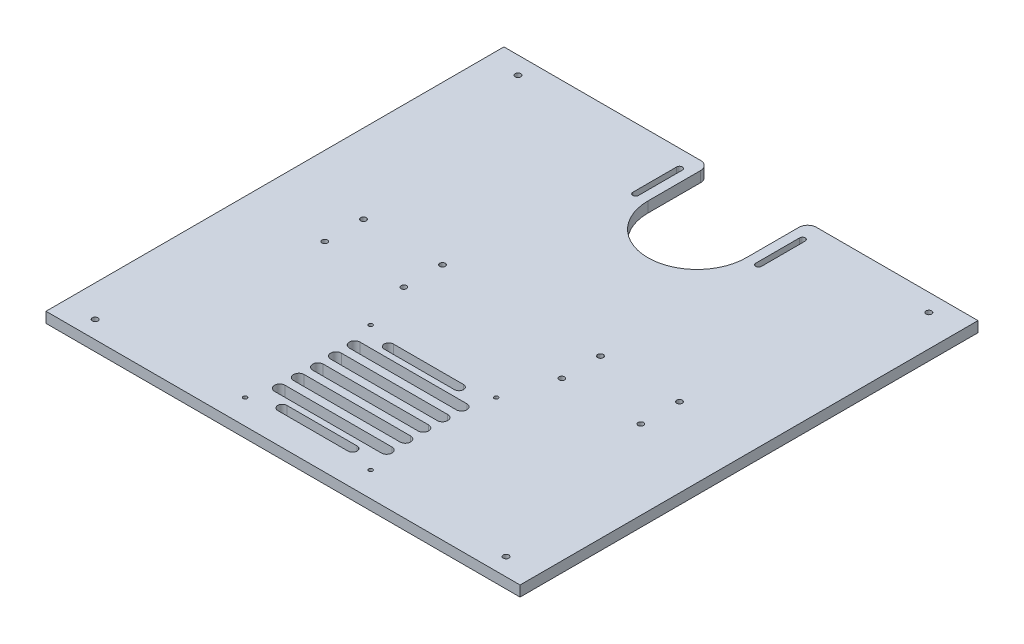
from build123d import *

# Parameters (mm, degrees)
SKETCH1_R               = 1.6
BOSS_EXTRUDE1_DEPTH     = 6
CUT_EXTRUDE1_DEPTH      = 203.20197823
CUT_EXTRUDE1_DEPTH_BACK = 203.20197823
SKETCH4_R               = 1.6
CUT_EXTRUDE2_DEPTH      = 10
CUT_EXTRUDE3_DEPTH      = 10
FILLET1_R               = 5
SKETCH6_R               = 1.125
CUT_EXTRUDE4_DEPTH      = 10
SKETCH7_R               = 1.55
CUT_EXTRUDE5_DEPTH      = 10


with BuildPart() as part:
    # Sketch1 → Boss-Extrude1 (new body)
    with BuildSketch(Plane(origin=(0, 0, 0), x_dir=(1, 0, 0), z_dir=(0, 1, 0))):
        Polygon((-145, 120), (125, 120), (125, -100.8), (125, -140.8), (-145, -140.8), (-145, -100.8), align=None)
        with Locations(Location((-100, -5, 0), (0, 0, 270))):
            Circle(SKETCH1_R, mode=Mode.SUBTRACT)
        with Locations(Location((80, -5, 0), (0, 0, 270))):
            Circle(SKETCH1_R, mode=Mode.SUBTRACT)
        with Locations(Location((-55, -5, 0), (0, 0, 270))):
            Circle(SKETCH1_R, mode=Mode.SUBTRACT)
        with Locations(Location((35, -5, 0), (0, 0, 270))):
            Circle(SKETCH1_R, mode=Mode.SUBTRACT)
    extrude(amount=BOSS_EXTRUDE1_DEPTH)

    # Sketch3 → Cut-Extrude1 (cut, two sides: drawn at the far end of the back side and taken through both)
    with BuildSketch(Plane(origin=(0, 6, 0), x_dir=(1, 0, 0), z_dir=(0, 1, 0)).offset(-CUT_EXTRUDE1_DEPTH_BACK)):
        with BuildLine():
            Line((-28, 85), (-28, 120))
            Line((-28, 120), (28, 120))
            Line((28, 120), (28, 85))
            ThreePointArc((28, 85), (0, 57), (-28, 85))
        make_face()
    extrude(amount=CUT_EXTRUDE1_DEPTH + CUT_EXTRUDE1_DEPTH_BACK, mode=Mode.SUBTRACT)

    # Sketch4 → Cut-Extrude2 (cut)
    with BuildSketch(Plane.XZ):
        with Locations(Location((107, -110, 0), (0, 0, 270))):
            Circle(SKETCH4_R)
        with Locations(Location((-127, -110, 0), (0, 0, 270))):
            Circle(SKETCH4_R)
        with Locations(Location((107, 130.8, 0), (0, 0, 270))):
            Circle(SKETCH4_R)
        with Locations(Location((-127, 130.8, 0), (0, 0, 270))):
            Circle(SKETCH4_R)
    extrude(amount=-CUT_EXTRUDE2_DEPTH, mode=Mode.SUBTRACT)

    # Sketch5 → Cut-Extrude3 (cut)
    with BuildSketch(Plane(origin=(0, 6, 0), x_dir=(1, 0, 0), z_dir=(0, 1, 0))):
        with BuildLine():
            Line((-33.4, 110), (-33.4, 85))
            ThreePointArc((-33.4, 85), (-35, 83.4), (-36.6, 85))
            Line((-36.6, 85), (-36.6, 110))
            ThreePointArc((-36.6, 110), (-35, 111.6), (-33.4, 110))
        make_face()
        with BuildLine():
            Line((33.4, 110), (33.4, 85))
            ThreePointArc((33.4, 85), (35, 83.4), (36.6, 85))
            Line((36.6, 85), (36.6, 110))
            ThreePointArc((36.6, 110), (35, 111.6), (33.4, 110))
        make_face()
    extrude(amount=-CUT_EXTRUDE3_DEPTH, mode=Mode.SUBTRACT)

    # Fillet1
    fillet1_edges = [part.edges().sort_by_distance(p)[0] for p in [
        (-28, 3, -120),
        (28, 3, -120),
    ]]
    fillet(fillet1_edges, radius=FILLET1_R)

    # Sketch6 → Cut-Extrude4 (cut)
    with BuildSketch(Plane(origin=(0, 6, 0), x_dir=(1, 0, 0), z_dir=(0, 1, 0))):
        with Locations(Location((25.75, -55.149373751, 0), (0, 0, 270))):
            Circle(SKETCH6_R)
        with Locations(Location((-45.75, -55.149373751, 0), (0, 0, 270))):
            Circle(SKETCH6_R)
        with Locations(Location((-45.75, -126.649373751, 0), (0, 0, 270))):
            Circle(SKETCH6_R)
        with Locations(Location((25.75, -126.649373751, 0), (0, 0, 270))):
            Circle(SKETCH6_R)
        with BuildLine():
            Line((-40, -87.899373751), (20, -87.899373751))
            ThreePointArc((20, -87.899373751), (23, -90.899373751), (20, -93.899373751))
            Line((20, -93.899373751), (-40, -93.899373751))
            ThreePointArc((-40, -93.899373751), (-43, -90.899373751), (-40, -87.899373751))
        make_face()
        with BuildLine():
            Line((-40.316760433, -77.325947728), (20.316760433, -77.325947728))
            ThreePointArc((20.316760433, -77.325947728), (23.316760433, -80.325947728), (20.316760433, -83.325947728))
            Line((20.316760433, -83.325947728), (-40.316760433, -83.325947728))
            ThreePointArc((-40.316760433, -83.325947728), (-43.316760433, -80.325947728), (-40.316760433, -77.325947728))
        make_face()
        with BuildLine():
            Line((-40.436008981, -66.571059525), (20.436008981, -66.571059525))
            ThreePointArc((20.436008981, -66.571059525), (23.436008981, -69.571059525), (20.436008981, -72.571059525))
            Line((20.436008981, -72.571059525), (-40.436008981, -72.571059525))
            ThreePointArc((-40.436008981, -72.571059525), (-43.436008981, -69.571059525), (-40.436008981, -66.571059525))
        make_face()
        with BuildLine():
            Line((-30, -58.021465569), (10, -58.021465569))
            ThreePointArc((10, -58.021465569), (12.570860459, -60.592326028), (10, -63.163186487))
            Line((10, -63.163186487), (-30, -63.163186487))
            ThreePointArc((-30, -63.163186487), (-32.570860459, -60.592326028), (-30, -58.021465569))
        make_face()
        with BuildLine():
            Line((-30, -123.777281933), (10, -123.777281933))
            ThreePointArc((10, -123.777281933), (12.570860459, -121.206421475), (10, -118.635561016))
            Line((10, -118.635561016), (-30, -118.635561016))
            ThreePointArc((-30, -118.635561016), (-32.570860459, -121.206421475), (-30, -123.777281933))
        make_face()
        with BuildLine():
            Line((-40.436008981, -115.227687978), (20.436008981, -115.227687978))
            ThreePointArc((20.436008981, -115.227687978), (23.436008981, -112.227687978), (20.436008981, -109.227687978))
            Line((20.436008981, -109.227687978), (-40.436008981, -109.227687978))
            ThreePointArc((-40.436008981, -109.227687978), (-43.436008981, -112.227687978), (-40.436008981, -115.227687978))
        make_face()
        with BuildLine():
            Line((-40.316760433, -104.472799775), (20.316760433, -104.472799775))
            ThreePointArc((20.316760433, -104.472799775), (23.316760433, -101.472799775), (20.316760433, -98.472799775))
            Line((20.316760433, -98.472799775), (-40.316760433, -98.472799775))
            ThreePointArc((-40.316760433, -98.472799775), (-43.316760433, -101.472799775), (-40.316760433, -104.472799775))
        make_face()
    extrude(amount=-CUT_EXTRUDE4_DEPTH, mode=Mode.SUBTRACT)

    # Sketch7 → Cut-Extrude5 (cut)
    with BuildSketch(Plane(origin=(0, 6, 0), x_dir=(1, 0, 0), z_dir=(0, 1, 0))):
        with Locations(Location((-100, -27, 0), (0, 0, 270))):
            Circle(SKETCH7_R)
        with Locations(Location((-55, -27, 0), (0, 0, 270))):
            Circle(SKETCH7_R)
        with Locations(Location((35, -27, 0), (0, 0, 270))):
            Circle(SKETCH7_R)
        with Locations(Location((80, -27, 0), (0, 0, 270))):
            Circle(SKETCH7_R)
    extrude(amount=-CUT_EXTRUDE5_DEPTH, mode=Mode.SUBTRACT)


solid = part.part
